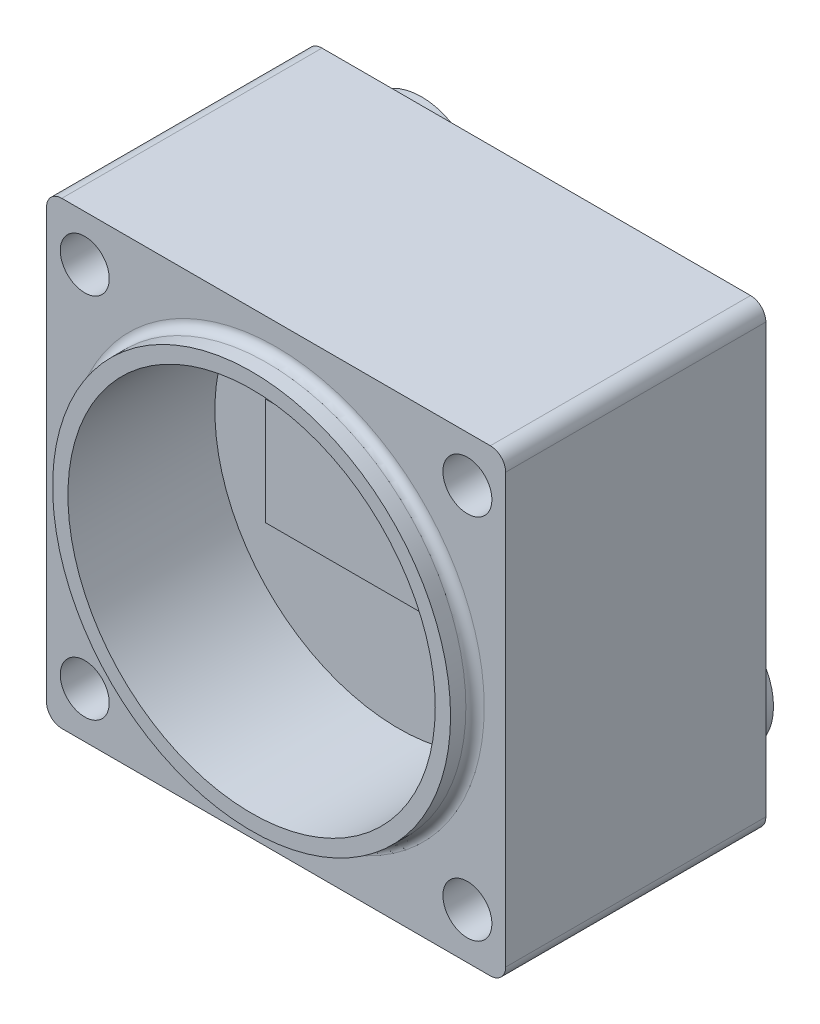
from build123d import *
from build123d.topology import SkipClean

# Parameters (mm, degrees)
SKETCH1_W                   = 15
SKETCH1_H                   = 15
BOSS_EXTRUDE1_DEPTH         = 8.5
SKETCH2_R                   = 6.5
SKETCH2_R_2                 = 6
BOSS_EXTRUDE2_DEPTH         = 0.8
FILLET1_R                   = 0.3
CUT_EXTRUDE1_START          = -4
SKETCH3_R                   = 6
CUT_EXTRUDE1_DEPTH          = 4
FILLET2_R                   = 0.5
SKETCH4_W                   = 7.5
SKETCH4_H                   = 3.5
BOSS_EXTRUDE3_DEPTH         = 0.6
TAP_DRILL_FOR_M2_TAP1_D     = 1.6
TAP_DRILL_FOR_M2_TAP1_DEPTH = 2.5
TAP_DRILL_FOR_M3_TAP1_D     = 2.5
TAP_DRILL_FOR_M3_TAP1_DEPTH = 2.25
SKETCH11_R                  = 2
SKETCH11_R_2                = 1.25
BOSS_EXTRUDE4_DEPTH         = 1
SKETCH12_W                  = 5
SKETCH12_H                  = 2.5
CUT_EXTRUDE2_DEPTH          = 0.4
BOSS_EXTRUDE5_DEPTH         = 0.2


with BuildPart() as part:
    # Sketch1 → Boss-Extrude1 (new body)
    with BuildSketch(Plane.XY):
        Rectangle(SKETCH1_W, SKETCH1_H)
    extrude(amount=BOSS_EXTRUDE1_DEPTH)

    # Sketch2 → Boss-Extrude2 (add)
    with BuildSketch(Plane.XY.offset(8.5)):
        Circle(SKETCH2_R)
        Circle(SKETCH2_R_2, mode=Mode.SUBTRACT)
    extrude(amount=BOSS_EXTRUDE2_DEPTH)

    # Fillet1
    fillet1_edges = [part.edges().sort_by_distance(p)[0] for p in [
        (-6.5, 0, 8.5),
    ]]
    fillet(fillet1_edges, radius=FILLET1_R)

    # Sketch3 → Cut-Extrude1 (cut)
    with BuildSketch(Plane.XY.offset(8.5).offset(CUT_EXTRUDE1_START)):
        Circle(SKETCH3_R)
    extrude(amount=CUT_EXTRUDE1_DEPTH, mode=Mode.SUBTRACT)

    # Fillet2
    fillet2_edges = [part.edges().sort_by_distance(p)[0] for p in [
        (-7.5, 7.5, 4.25),
        (7.5, 7.5, 4.25),
        (7.5, -7.5, 4.25),
        (-7.5, -7.5, 4.25),
    ]]
    fillet(fillet2_edges, radius=FILLET2_R)

    # Sketch4 → Boss-Extrude3 (add)
    with BuildSketch(Plane.XY.offset(4.5)):
        Rectangle(SKETCH4_W, SKETCH4_H)
    extrude(amount=BOSS_EXTRUDE3_DEPTH)

    # Tap Drill for M2 Tap1
    with Locations(Plane.XY.offset(8.5)):
        with Locations((-6.25, 6), (6.25, 6), (6.25, -6), (-6.25, -6)):
            Hole(TAP_DRILL_FOR_M2_TAP1_D / 2, depth=TAP_DRILL_FOR_M2_TAP1_DEPTH)

    # Tap Drill for M3 Tap1
    with Locations(Plane(origin=(0, 0, 0), x_dir=(-1, 0, 0), z_dir=(0, 0, -1))):
        with Locations((4.75, 4.75), (-4.75, -4.75)):
            Hole(TAP_DRILL_FOR_M3_TAP1_D / 2, depth=TAP_DRILL_FOR_M3_TAP1_DEPTH)

    # Sketch11 → Boss-Extrude4 (add)
    # profile 1 of 2: a face of its own
    with SkipClean():  # the faces are left unmerged after this step: merging them gives an invalid solid
        with BuildSketch(Plane(origin=(0, 0, 0), x_dir=(-1, 0, 0), z_dir=(0, 0, -1))):
            with Locations(Location((-4.75, -4.75, 0), (0, 0, 180))):
                Circle(SKETCH11_R)
            with Locations((-4.75, -4.75)):
                Circle(SKETCH11_R_2, mode=Mode.SUBTRACT)
        # profile 2 of 2: a face of its own
        with BuildSketch(Plane(origin=(0, 0, 0), x_dir=(-1, 0, 0), z_dir=(0, 0, -1))):
            with Locations(Location((4.75, 4.75, 0), (0, 0, 180))):
                Circle(SKETCH11_R)
            with Locations((4.75, 4.75)):
                Circle(SKETCH11_R_2, mode=Mode.SUBTRACT)
        extrude(amount=BOSS_EXTRUDE4_DEPTH)

    # Sketch12 → Cut-Extrude2 (cut)
    with SkipClean():  # the faces are left unmerged after this step: merging them gives an invalid solid
        with BuildSketch(Plane(origin=(0, 0, 0), x_dir=(-1, 0, 0), z_dir=(0, 0, -1))):
            with Locations((-2.7, 4)):
                Rectangle(SKETCH12_W, SKETCH12_H)
        extrude(amount=-CUT_EXTRUDE2_DEPTH, mode=Mode.SUBTRACT)

    # Sketch13 → Boss-Extrude5 (add)
    # profile 1 of 12: a face of its own
    with SkipClean():  # the faces are left unmerged after this step: merging them gives an invalid solid
        with BuildSketch(Plane(origin=(0, 0, 0.4), x_dir=(-1, 0, 0), z_dir=(0, 0, -1))):
            with BuildLine():
                Line((-4.668821069, 4.085005407), (-4.600979189, 4.085005407))
                Line((-4.600979189, 4.085005407), (-4.600979189, 3.912856635))
                add(Edge.make_bspline(
                    [(-4.600979189, 3.912856635), (-4.600949528, 3.911072208), (-4.600892243, 3.907625851), (-4.600718619, 3.902672115), (-4.600286284, 3.898127314), (-4.599688066, 3.893995357), (-4.599050164, 3.890225728), (-4.598138113, 3.88688177), (-4.597099975, 3.883943097), (-4.595446545, 3.880585345), (-4.592870724, 3.876804782), (-4.588820933, 3.872940053), (-4.584091056, 3.869391561), (-4.578479821, 3.866455717), (-4.572158554, 3.864089282), (-4.565194463, 3.862335882), (-4.557599025, 3.861350194), (-4.552344338, 3.861203325), (-4.549620766, 3.861127201)],
                    knots=[0, 0, 0, 0, 1.009117585, 1.948962016, 2.801805322, 3.588681075, 4.309712397, 4.961548031, 5.546157113, 6.068856501, 7.074655996, 8.113015292, 9.219846505, 10.40857379, 11.679455231, 13.028936014, 14.460058655, 16, 16, 16, 16], degree=3))
                add(Edge.make_bspline(
                    [(-4.549620766, 3.861127201), (-4.546736438, 3.861188397), (-4.541136905, 3.861307201), (-4.533057242, 3.862508987), (-4.525566275, 3.86437052), (-4.518805958, 3.867087173), (-4.512825167, 3.870321092), (-4.507781064, 3.874042926), (-4.503684974, 3.878165152), (-4.501095998, 3.882107228), (-4.499533877, 3.885677996), (-4.498545123, 3.888880657), (-4.497721767, 3.892625708), (-4.496969696, 3.89688273), (-4.496462832, 3.901700184), (-4.49611992, 3.907040578), (-4.495819817, 3.912924093), (-4.495822747, 3.917025642), (-4.495824275, 3.91916381)],
                    knots=[0, 0, 0, 0, 1.491008905, 2.894591862, 4.215656619, 5.474865643, 6.652787714, 7.723869584, 8.706202526, 9.644083989, 10.143303943, 10.718472251, 11.374691523, 12.125915579, 12.953475506, 13.878715633, 14.894158897, 16, 16, 16, 16], degree=3))
                Line((-4.495824275, 3.91916381), (-4.495824275, 4.085005407))
                Line((-4.495824275, 4.085005407), (-4.427982394, 4.085005407))
                Line((-4.427982394, 4.085005407), (-4.427982394, 3.927167032))
                add(Edge.make_bspline(
                    [(-4.427982394, 3.927167032), (-4.428007134, 3.92396921), (-4.428054709, 3.91781977), (-4.428292044, 3.908981387), (-4.42879384, 3.900907803), (-4.429360579, 3.893595318), (-4.430311327, 3.887065814), (-4.431268077, 3.881268013), (-4.432455943, 3.876225879), (-4.43439509, 3.870473113), (-4.437642704, 3.863826011), (-4.442828141, 3.856251988), (-4.44935584, 3.848818075), (-4.45713569, 3.841666522), (-4.465883724, 3.835001245), (-4.475409106, 3.829142054), (-4.485601137, 3.824234281), (-4.496496146, 3.820318007), (-4.508165042, 3.817264158), (-4.520696221, 3.815230431), (-4.534113142, 3.813838425), (-4.543362745, 3.813706154), (-4.548136724, 3.813637885)],
                    knots=[0, 0, 0, 0, 1.002104641, 1.927056277, 2.770025148, 3.53689708, 4.224316834, 4.836856441, 5.377985188, 5.845421336, 6.73681054, 7.685739899, 8.713795979, 9.830302055, 10.991812556, 12.154944736, 13.328621968, 14.53000517, 15.777458768, 17.102624325, 18.504583029, 20, 20, 20, 20], degree=3))
                add(Edge.make_bspline(
                    [(-4.548136724, 3.813637885), (-4.551318082, 3.813675359), (-4.557563667, 3.813748927), (-4.56677502, 3.814425078), (-4.575676703, 3.815399368), (-4.584276305, 3.816832228), (-4.592559049, 3.818683561), (-4.60052651, 3.82095799), (-4.608163576, 3.823672596), (-4.615456495, 3.826729324), (-4.622341295, 3.830111405), (-4.628733089, 3.833765097), (-4.634656096, 3.837587744), (-4.640073379, 3.841605), (-4.644973305, 3.845849006), (-4.649339963, 3.850327365), (-4.653225329, 3.854990727), (-4.656665211, 3.859956222), (-4.659579956, 3.865505567), (-4.662049107, 3.871803182), (-4.664155075, 3.878952305), (-4.665883591, 3.886941491), (-4.667183305, 3.895797117), (-4.668115123, 3.905490802), (-4.668699597, 3.916047302), (-4.668779566, 3.923367797), (-4.668821069, 3.927167032)],
                    knots=[0, 0, 0, 0, 1.194681672, 2.345378368, 3.467245921, 4.55702161, 5.617889756, 6.653301422, 7.666967707, 8.660253073, 9.621734216, 10.545997581, 11.423914759, 12.267952269, 13.076937024, 13.855864633, 14.614547226, 15.354425808, 16.120242101, 16.963052831, 17.890977035, 18.916583062, 20.030494565, 21.250647704, 22.573124445, 24, 24, 24, 24], degree=3))
                Line((-4.668821069, 3.927167032), (-4.668821069, 4.085005407))
            make_face()
        # profile 2 of 12: a face of its own
        with BuildSketch(Plane(origin=(0, 0, 0.4), x_dir=(-1, 0, 0), z_dir=(0, 0, -1))):
            with BuildLine():
                Line((-4.126086027, 4.049653427), (-4.175536397, 4.017163526))
                add(Edge.make_bspline(
                    [(-4.175536397, 4.017163526), (-4.177676191, 4.019319081), (-4.18183125, 4.023504742), (-4.188427477, 4.02901326), (-4.195006567, 4.033714699), (-4.201621452, 4.037595063), (-4.208310279, 4.040572143), (-4.215026245, 4.042710804), (-4.221770785, 4.044054584), (-4.226288146, 4.044218597), (-4.228537866, 4.044300278)],
                    knots=[0, 0, 0, 0, 1.190525164, 2.311765056, 3.36520098, 4.358604661, 5.313879002, 6.229751941, 7.118387239, 8, 8, 8, 8], degree=3))
                add(Edge.make_bspline(
                    [(-4.228537866, 4.044300278), (-4.230626883, 4.044248655), (-4.234637328, 4.044149551), (-4.2403683, 4.043136738), (-4.245512787, 4.04144168), (-4.249989741, 4.039150591), (-4.253612034, 4.036438477), (-4.25637651, 4.033545339), (-4.258033777, 4.030319347), (-4.258265432, 4.028062484), (-4.258377693, 4.026968798)],
                    knots=[0, 0, 0, 0, 1.330159043, 2.553607876, 3.692836374, 4.770373652, 5.743066602, 6.563974043, 7.304095923, 8, 8, 8, 8], degree=3))
                add(Edge.make_bspline(
                    [(-4.258377693, 4.026968798), (-4.258303641, 4.025864627), (-4.258153019, 4.023618774), (-4.256969182, 4.020318634), (-4.255015539, 4.017162131), (-4.253288342, 4.0152813), (-4.252388527, 4.014301447)],
                    knots=[0, 0, 0, 0, 0.920298768, 1.871862052, 2.891308131, 4, 4, 4, 4], degree=3))
                add(Edge.make_bspline(
                    [(-4.252388527, 4.014301447), (-4.251551405, 4.013528772), (-4.249594355, 4.011722388), (-4.245919012, 4.008980343), (-4.241350508, 4.005514238), (-4.235688126, 4.00155425), (-4.229035676, 3.997001186), (-4.221310659, 3.991936769), (-4.212646277, 3.986178079), (-4.206461264, 3.982241949), (-4.203203164, 3.980168501)],
                    knots=[0, 0, 0, 0, 0.45603203, 1.0661256, 1.834627495, 2.75350167, 3.833023019, 5.063610394, 6.45318828, 8, 8, 8, 8], degree=3))
                add(Edge.make_bspline(
                    [(-4.203203164, 3.980168501), (-4.200164773, 3.978242244), (-4.194402706, 3.974589253), (-4.186218085, 3.969412137), (-4.179025121, 3.964714706), (-4.172707011, 3.960686386), (-4.167408109, 3.957097007), (-4.162993014, 3.954135379), (-4.159508661, 3.951742995), (-4.157547416, 3.950263266), (-4.156720876, 3.949639655)],
                    knots=[0, 0, 0, 0, 1.552293685, 2.943801188, 4.178653364, 5.259149018, 6.176746603, 6.940011425, 7.553282258, 8, 8, 8, 8], degree=3))
                add(Edge.make_bspline(
                    [(-4.156720876, 3.949639655), (-4.153537748, 3.947123527), (-4.147480736, 3.942335716), (-4.139462494, 3.934824888), (-4.132877268, 3.927495181), (-4.127769956, 3.920180608), (-4.123997282, 3.912757281), (-4.121216496, 3.905141297), (-4.11960778, 3.897147446), (-4.119404336, 3.891698319), (-4.119301839, 3.888952973)],
                    knots=[0, 0, 0, 0, 1.312468895, 2.497429846, 3.550423517, 4.495533471, 5.375034974, 6.237577385, 7.112066805, 8, 8, 8, 8], degree=3))
                add(Edge.make_bspline(
                    [(-4.119301839, 3.888952973), (-4.119387749, 3.886277812), (-4.119556868, 3.881011647), (-4.121071335, 3.87331213), (-4.123348453, 3.865934316), (-4.126784742, 3.858993531), (-4.131046891, 3.852345447), (-4.136325551, 3.846101835), (-4.142556914, 3.840238088), (-4.149618328, 3.834767985), (-4.157449451, 3.829811789), (-4.165901651, 3.825448056), (-4.174952917, 3.821788541), (-4.184589913, 3.81883512), (-4.194778537, 3.816516854), (-4.205541266, 3.814816723), (-4.216875466, 3.81380127), (-4.224631318, 3.813693106), (-4.228590868, 3.813637885)],
                    knots=[0, 0, 0, 0, 0.868811549, 1.71029202, 2.542211582, 3.371927485, 4.219482013, 5.104152839, 6.022326931, 6.99656169, 8.003564138, 9.031077577, 10.084838529, 11.1730359, 12.304379326, 13.479039229, 14.712988716, 16, 16, 16, 16], degree=3))
                add(Edge.make_bspline(
                    [(-4.228590868, 3.813637885), (-4.231701384, 3.813677612), (-4.2378407, 3.813756022), (-4.24689776, 3.814406524), (-4.255655583, 3.815455898), (-4.264097283, 3.816935533), (-4.272236584, 3.818849941), (-4.280081603, 3.821171565), (-4.2876235, 3.823931297), (-4.2948737, 3.827117917), (-4.301832931, 3.830785821), (-4.308527197, 3.834929848), (-4.314953336, 3.83955457), (-4.321135597, 3.844669732), (-4.327041643, 3.850288861), (-4.332751858, 3.856350475), (-4.338163413, 3.862925509), (-4.341493995, 3.867608012), (-4.343180044, 3.869978447)],
                    knots=[0, 0, 0, 0, 1.118567985, 2.207749923, 3.263810248, 4.289619113, 5.288307529, 6.26935655, 7.230197879, 8.174681463, 9.115438921, 10.05701139, 11.003928279, 11.960643095, 12.940456797, 13.933876122, 14.954061372, 16, 16, 16, 16], degree=3))
                Line((-4.343180044, 3.869978447), (-4.286680478, 3.895048142))
                add(Edge.make_bspline(
                    [(-4.286680478, 3.895048142), (-4.284555144, 3.892357092), (-4.280438615, 3.887144838), (-4.273666226, 3.880230675), (-4.266704418, 3.874325009), (-4.259454071, 3.869505287), (-4.251940111, 3.865759337), (-4.244176302, 3.863081789), (-4.236169321, 3.861428912), (-4.230736319, 3.861228067), (-4.228007852, 3.861127201)],
                    knots=[0, 0, 0, 0, 1.168605251, 2.263454204, 3.293961514, 4.276421015, 5.224765032, 6.148763627, 7.070304121, 8, 8, 8, 8], degree=3))
                add(Edge.make_bspline(
                    [(-4.228007852, 3.861127201), (-4.225226243, 3.861207766), (-4.219870529, 3.861362886), (-4.212197837, 3.86285932), (-4.205156825, 3.865116041), (-4.199042857, 3.868493762), (-4.193835383, 3.872252571), (-4.190061787, 3.876582428), (-4.187574248, 3.881241872), (-4.187285819, 3.884561443), (-4.187143719, 3.886196896)],
                    knots=[0, 0, 0, 0, 1.271814217, 2.448753583, 3.56637365, 4.641061586, 5.634205734, 6.488609534, 7.255383409, 8, 8, 8, 8], degree=3))
                add(Edge.make_bspline(
                    [(-4.187143719, 3.886196896), (-4.187242019, 3.887714807), (-4.187444635, 3.890843524), (-4.189324813, 3.895416319), (-4.192124959, 3.899996765), (-4.195416485, 3.903680007), (-4.19874683, 3.906793034), (-4.201995671, 3.909463479), (-4.205857558, 3.912503333), (-4.210439064, 3.915755136), (-4.215640131, 3.919375449), (-4.221515073, 3.923295458), (-4.228096883, 3.927459107), (-4.232705608, 3.930332217), (-4.235110048, 3.931831161)],
                    knots=[0, 0, 0, 0, 0.794434314, 1.637487225, 2.562413113, 3.608512959, 4.219241158, 4.95728375, 5.816984293, 6.801079997, 7.908280076, 9.146584944, 10.511331137, 12, 12, 12, 12], degree=3))
                add(Edge.make_bspline(
                    [(-4.235110048, 3.931831161), (-4.239692219, 3.934682984), (-4.248484905, 3.940155322), (-4.260999736, 3.948169688), (-4.27220543, 3.955774636), (-4.282158989, 3.962832058), (-4.29082203, 3.969406534), (-4.298230247, 3.975450265), (-4.304394285, 3.980961801), (-4.309379439, 3.986114937), (-4.313365807, 3.991062078), (-4.316803319, 3.995862869), (-4.319725322, 4.000649085), (-4.3220748, 4.005484923), (-4.323961136, 4.010275056), (-4.325213627, 4.01510211), (-4.326068533, 4.019889261), (-4.326169431, 4.023096075), (-4.326219574, 4.024689735)],
                    knots=[0, 0, 0, 0, 1.916196781, 3.676973209, 5.275785729, 6.723906262, 8.008545569, 9.136149616, 10.117571378, 10.942733828, 11.678437588, 12.371144969, 13.038098532, 13.6664772, 14.278038524, 14.862291426, 15.434603922, 16, 16, 16, 16], degree=3))
                add(Edge.make_bspline(
                    [(-4.326219574, 4.024689735), (-4.326144456, 4.02695785), (-4.325995823, 4.031445716), (-4.324608709, 4.038047173), (-4.322369678, 4.044386303), (-4.319260836, 4.050475865), (-4.315281279, 4.056306013), (-4.310425627, 4.061889677), (-4.304654734, 4.067178689), (-4.298113315, 4.072186498), (-4.290912774, 4.076727613), (-4.283260114, 4.080798146), (-4.275156832, 4.0841757), (-4.266659658, 4.087003366), (-4.257739803, 4.089161891), (-4.24842204, 4.090696602), (-4.238696788, 4.09160112), (-4.232073207, 4.091725959), (-4.228696871, 4.091789595)],
                    knots=[0, 0, 0, 0, 0.832202766, 1.646659515, 2.465524548, 3.295498105, 4.150387516, 5.051997593, 6.007082385, 7.020705296, 8.073791693, 9.130350931, 10.200531492, 11.294237454, 12.416370906, 13.567418749, 14.760004378, 16, 16, 16, 16], degree=3))
                add(Edge.make_bspline(
                    [(-4.228696871, 4.091789595), (-4.224309618, 4.091677322), (-4.215625752, 4.091455096), (-4.202768825, 4.089684113), (-4.190230202, 4.086914483), (-4.180026983, 4.083548442), (-4.171922047, 4.080260083), (-4.16571293, 4.077279587), (-4.15941329, 4.073792934), (-4.152921373, 4.069971908), (-4.146421778, 4.06548655), (-4.139682949, 4.060723422), (-4.132888528, 4.055378929), (-4.128389507, 4.051592211), (-4.126086027, 4.049653427)],
                    knots=[0, 0, 0, 0, 1.389820793, 2.750928363, 4.10510972, 5.45420087, 6.149736827, 6.875939553, 7.635083208, 8.431051425, 9.261799364, 10.136509639, 11.045900652, 12, 12, 12, 12], degree=3))
            make_face()
        # profile 3 of 12: a face of its own
        with BuildSketch(Plane(origin=(0, 0, 0.4), x_dir=(-1, 0, 0), z_dir=(0, 0, -1))):
            with BuildLine():
                Line((-4.024323206, 3.820422073), (-4.024323206, 4.085005407))
                Line((-4.024323206, 4.085005407), (-3.966498603, 4.085005407))
                add(Edge.make_bspline(
                    [(-3.966498603, 4.085005407), (-3.962452627, 4.085005827), (-3.954624699, 4.085006641), (-3.943317213, 4.084714325), (-3.932840483, 4.084341155), (-3.923222343, 4.083916621), (-3.914443984, 4.083192944), (-3.906504853, 4.082427261), (-3.899391277, 4.081506349), (-3.894961268, 4.080677677), (-3.892879563, 4.080288276)],
                    knots=[0, 0, 0, 0, 1.314476142, 2.543174751, 3.67467149, 4.72063089, 5.670668527, 6.535965194, 7.312035703, 8, 8, 8, 8], degree=3))
                add(Edge.make_bspline(
                    [(-3.892879563, 4.080288276), (-3.890186546, 4.079737884), (-3.88490593, 4.078658645), (-3.877284792, 4.076522441), (-3.870086922, 4.074071581), (-3.863287671, 4.071338099), (-3.856906646, 4.068208185), (-3.850964016, 4.064701398), (-3.845432715, 4.060880683), (-3.840350103, 4.056767392), (-3.835782382, 4.052377375), (-3.831802314, 4.047754931), (-3.828363465, 4.042975444), (-3.825581206, 4.037961456), (-3.823468836, 4.032736502), (-3.821900509, 4.027344074), (-3.820989495, 4.021734881), (-3.820862093, 4.017926435), (-3.820797565, 4.015997494)],
                    knots=[0, 0, 0, 0, 1.257922464, 2.466603506, 3.620043909, 4.737393883, 5.818840065, 6.870202274, 7.893186651, 8.893542983, 9.860148194, 10.789108699, 11.682244951, 12.551029152, 13.407072112, 14.256903723, 15.117138701, 16, 16, 16, 16], degree=3))
                add(Edge.make_bspline(
                    [(-3.820797565, 4.015997494), (-3.820907246, 4.013513714), (-3.821124711, 4.008589096), (-3.822944945, 4.001399887), (-3.825914008, 3.994575866), (-3.830059486, 3.988049898), (-3.835624556, 3.981893538), (-3.842535473, 3.97594358), (-3.850924167, 3.970230674), (-3.857159854, 3.966810597), (-3.860442664, 3.965010081)],
                    knots=[0, 0, 0, 0, 0.872773716, 1.73045845, 2.590594071, 3.481956528, 4.43730071, 5.499037926, 6.683355727, 8, 8, 8, 8], degree=3))
                add(Edge.make_bspline(
                    [(-3.860442664, 3.965010081), (-3.857784019, 3.964061046), (-3.852603628, 3.962211844), (-3.845191039, 3.959138621), (-3.838314, 3.955910448), (-3.832011819, 3.95247745), (-3.826265177, 3.948857538), (-3.821035917, 3.945118545), (-3.816411711, 3.94112115), (-3.812312815, 3.936963988), (-3.808660443, 3.932676196), (-3.805590408, 3.928115618), (-3.802910015, 3.923424865), (-3.800802109, 3.918484188), (-3.799067868, 3.913411176), (-3.797942614, 3.908106091), (-3.797139041, 3.902634302), (-3.797081901, 3.898902667), (-3.797052907, 3.897009196)],
                    knots=[0, 0, 0, 0, 1.354375528, 2.639011242, 3.848679929, 4.998155777, 6.080063206, 7.105953475, 8.07969673, 9.00883845, 9.905387834, 10.777723636, 11.643111739, 12.493547544, 13.351387362, 14.211110016, 15.092298084, 16, 16, 16, 16], degree=3))
                add(Edge.make_bspline(
                    [(-3.797052907, 3.897009196), (-3.797106459, 3.895186784), (-3.797212962, 3.891562382), (-3.797989539, 3.886189632), (-3.799177684, 3.880922889), (-3.800981897, 3.875798286), (-3.803172015, 3.87077702), (-3.805934281, 3.865896948), (-3.809154102, 3.861141695), (-3.812868304, 3.856557449), (-3.816941468, 3.852166666), (-3.82133017, 3.848035985), (-3.826024343, 3.844220011), (-3.830951976, 3.840635906), (-3.836222808, 3.837425648), (-3.841753314, 3.834438195), (-3.847573248, 3.831738728), (-3.853735331, 3.829341715), (-3.860303897, 3.827180223), (-3.867457289, 3.825429399), (-3.875168416, 3.823792708), (-3.883518733, 3.822651403), (-3.892419129, 3.821601356), (-3.9019352, 3.820952736), (-3.912044327, 3.820516879), (-3.918991106, 3.820454252), (-3.922560386, 3.820422073)],
                    knots=[0, 0, 0, 0, 0.801347207, 1.593714283, 2.383524159, 3.172377733, 3.979543986, 4.790181617, 5.63507033, 6.502807521, 7.382604636, 8.267705181, 9.151269301, 10.041980737, 10.945615365, 11.863505354, 12.805711295, 13.76534904, 14.770444682, 15.844744415, 17.00300248, 18.236059086, 19.549896115, 20.944554242, 22.430101194, 24, 24, 24, 24], degree=3))
                Line((-3.922560386, 3.820422073), (-4.024323206, 3.820422073))
            make_face()
            with BuildLine():
                Line((-3.956481326, 4.03751609), (-3.956481326, 3.979850492))
                Line((-3.956481326, 3.979850492), (-3.940686888, 3.979850492))
                add(Edge.make_bspline(
                    [(-3.940686888, 3.979850492), (-3.93854851, 3.979864679), (-3.934427215, 3.979892021), (-3.92844904, 3.98027419), (-3.922906399, 3.980880581), (-3.917782002, 3.981807164), (-3.913073229, 3.982874122), (-3.908786169, 3.984270476), (-3.904928896, 3.985886445), (-3.901493295, 3.98776758), (-3.898457873, 3.989822667), (-3.895818583, 3.992103203), (-3.893675368, 3.994641247), (-3.891738638, 3.997213661), (-3.890377761, 4.00009321), (-3.889354284, 4.003112738), (-3.888770785, 4.006329195), (-3.888683722, 4.008522085), (-3.888639445, 4.009637318)],
                    knots=[0, 0, 0, 0, 1.531470513, 2.951601988, 4.289032099, 5.522818593, 6.680046859, 7.744576757, 8.7482429, 9.671368044, 10.545391607, 11.370400094, 12.159694004, 12.921734149, 13.668811109, 14.429168115, 15.201126318, 16, 16, 16, 16], degree=3))
                add(Edge.make_bspline(
                    [(-3.888639445, 4.009637318), (-3.888689184, 4.010681064), (-3.888786769, 4.012728851), (-3.889286967, 4.015724313), (-3.890294608, 4.018521683), (-3.891583778, 4.021200683), (-3.893409094, 4.023627375), (-3.895447848, 4.02601054), (-3.897993024, 4.028107721), (-3.900852664, 4.030083226), (-3.90411181, 4.031825503), (-3.907747323, 4.033367168), (-3.911785774, 4.034693106), (-3.916238692, 4.035736318), (-3.921076929, 4.03651232), (-3.926294881, 4.037088188), (-3.931918162, 4.037475591), (-3.935810062, 4.037502276), (-3.937824809, 4.03751609)],
                    knots=[0, 0, 0, 0, 0.794923146, 1.559606406, 2.299305798, 3.050759689, 3.811771406, 4.602135162, 5.431762038, 6.311701388, 7.243988896, 8.237728068, 9.313205348, 10.473932854, 11.713699693, 13.039329106, 14.467328779, 16, 16, 16, 16], degree=3))
                Line((-3.937824809, 4.03751609), (-3.956481326, 4.03751609))
            make_face(mode=Mode.SUBTRACT)
            with BuildLine():
                Line((-3.956481326, 3.93575327), (-3.956481326, 3.86791139))
                Line((-3.956481326, 3.86791139), (-3.93893784, 3.86791139))
                add(Edge.make_bspline(
                    [(-3.93893784, 3.86791139), (-3.935439431, 3.867926036), (-3.928758409, 3.867954008), (-3.91917701, 3.868318918), (-3.910481712, 3.868959541), (-3.902659863, 3.869767505), (-3.895734951, 3.870857637), (-3.889718704, 3.872239398), (-3.884551714, 3.873776212), (-3.880201252, 3.87563857), (-3.876607213, 3.877845738), (-3.873424506, 3.880077777), (-3.870783235, 3.882661839), (-3.868682497, 3.885499189), (-3.866902651, 3.888484519), (-3.865785872, 3.891774141), (-3.864978108, 3.895238603), (-3.864922917, 3.897640201), (-3.864894787, 3.898864247)],
                    knots=[0, 0, 0, 0, 1.887021404, 3.603704538, 5.170790519, 6.58943757, 7.844387939, 8.949407294, 9.917011509, 10.749176432, 11.492815963, 12.188565757, 12.842251925, 13.475041814, 14.089703505, 14.707680747, 15.341331185, 16, 16, 16, 16], degree=3))
                add(Edge.make_bspline(
                    [(-3.864894787, 3.898864247), (-3.864937399, 3.90026505), (-3.865020767, 3.903005638), (-3.86592254, 3.906980894), (-3.867292157, 3.910745078), (-3.869280766, 3.914255034), (-3.87181355, 3.917539213), (-3.874924919, 3.920554245), (-3.878565447, 3.923382875), (-3.88278623, 3.925989072), (-3.887660016, 3.928340492), (-3.893262283, 3.930329986), (-3.899576195, 3.932006786), (-3.906628683, 3.93335909), (-3.914389317, 3.934485969), (-3.922921808, 3.935173362), (-3.932165312, 3.935675692), (-3.938583707, 3.93572681), (-3.941905922, 3.93575327)],
                    knots=[0, 0, 0, 0, 0.709311656, 1.387725954, 2.056844833, 2.73484476, 3.424876786, 4.153564022, 4.926109345, 5.759117077, 6.664857181, 7.665450765, 8.769654723, 9.975193512, 11.305789465, 12.744979308, 14.31517407, 16, 16, 16, 16], degree=3))
                Line((-3.941905922, 3.93575327), (-3.956481326, 3.93575327))
            make_face(mode=Mode.SUBTRACT)
        # profile 4 of 12: a face of its own
        with BuildSketch(Plane(origin=(0, 0, 0.4), x_dir=(-1, 0, 0), z_dir=(0, 0, -1))):
            with BuildLine():
                Line((-3.203436454, 4.039106134), (-3.250448757, 4.005821212))
                add(Edge.make_bspline(
                    [(-3.250448757, 4.005821212), (-3.254466978, 4.008887629), (-3.262398903, 4.014940703), (-3.274961126, 4.022834752), (-3.287967664, 4.029389389), (-3.301277226, 4.034922714), (-3.315031151, 4.039089894), (-3.329119229, 4.042124566), (-3.343593136, 4.043983198), (-3.353372166, 4.044193938), (-3.358306746, 4.044300278)],
                    knots=[0, 0, 0, 0, 1.038229587, 2.049454149, 3.043010366, 4.027894538, 5.007378552, 5.991352479, 6.986419527, 8, 8, 8, 8], degree=3))
                add(Edge.make_bspline(
                    [(-3.358306746, 4.044300278), (-3.362443656, 4.044216241), (-3.370576758, 4.044051026), (-3.382522842, 4.042827573), (-3.393963085, 4.040747442), (-3.404916734, 4.037916856), (-3.415346511, 4.034170705), (-3.425311397, 4.029668657), (-3.434758986, 4.024298291), (-3.443602358, 4.018189512), (-3.451689045, 4.011519609), (-3.458780787, 4.004361751), (-3.464766273, 3.996783754), (-3.469700392, 3.988854374), (-3.473504905, 3.980495341), (-3.4761983, 3.971750301), (-3.477917192, 3.962621583), (-3.478102323, 3.956396182), (-3.478196069, 3.953243755)],
                    knots=[0, 0, 0, 0, 1.187885248, 2.335364319, 3.443960736, 4.524407058, 5.580322512, 6.622472728, 7.660799934, 8.696583053, 9.70539989, 10.666872381, 11.584427089, 12.472863723, 13.342442026, 14.213794558, 15.095498587, 16, 16, 16, 16], degree=3))
                add(Edge.make_bspline(
                    [(-3.478196069, 3.953243755), (-3.47813646, 3.951033994), (-3.478018864, 3.946674595), (-3.477345193, 3.94021534), (-3.476093559, 3.93397283), (-3.474485401, 3.927889821), (-3.472277726, 3.922033994), (-3.469608066, 3.916363066), (-3.46655513, 3.910812711), (-3.462932247, 3.90553906), (-3.458899486, 3.900484093), (-3.454430462, 3.895722394), (-3.449592262, 3.891191676), (-3.444348965, 3.886957809), (-3.438700148, 3.883036678), (-3.43268992, 3.879359627), (-3.42625823, 3.87597535), (-3.419471169, 3.872858292), (-3.412356643, 3.870132706), (-3.405053809, 3.867660438), (-3.397520147, 3.865669655), (-3.389803871, 3.864037103), (-3.38192462, 3.862677889), (-3.373832295, 3.86182632), (-3.365560577, 3.861184995), (-3.359968782, 3.861146613), (-3.357140714, 3.861127201)],
                    knots=[0, 0, 0, 0, 0.937496524, 1.849486415, 2.750417344, 3.635754181, 4.515491188, 5.400574255, 6.292955863, 7.199200781, 8.110913523, 9.033495133, 9.966668607, 10.920525903, 11.889309348, 12.881519013, 13.907318609, 14.970354842, 16.047508483, 17.137618491, 18.239207974, 19.350391021, 20.482602104, 21.628789043, 22.800752546, 24, 24, 24, 24], degree=3))
                add(Edge.make_bspline(
                    [(-3.357140714, 3.861127201), (-3.352366445, 3.861229482), (-3.343004511, 3.861430044), (-3.329263354, 3.862991947), (-3.316159527, 3.865570594), (-3.305637704, 3.868618777), (-3.297397267, 3.871633613), (-3.291143936, 3.874457255), (-3.284678475, 3.877542221), (-3.278100493, 3.881130297), (-3.271348649, 3.885099444), (-3.264498929, 3.889561394), (-3.257463338, 3.894402091), (-3.252789031, 3.897843992), (-3.250395756, 3.899606268)],
                    knots=[0, 0, 0, 0, 1.483690097, 2.90938903, 4.292193086, 5.630334046, 6.309691641, 7.01780335, 7.761982048, 8.53595548, 9.345892649, 10.195833925, 11.076255288, 12, 12, 12, 12], degree=3))
                Line((-3.250395756, 3.899606268), (-3.204867494, 3.864148285))
                add(Edge.make_bspline(
                    [(-3.204867494, 3.864148285), (-3.208086086, 3.861848456), (-3.214418583, 3.857323602), (-3.224004598, 3.851006946), (-3.233516431, 3.845305084), (-3.242817191, 3.84003202), (-3.252001867, 3.835336998), (-3.261087286, 3.831288887), (-3.269981986, 3.827624225), (-3.278867883, 3.824613119), (-3.287824181, 3.82195918), (-3.297035177, 3.819775712), (-3.30652177, 3.817843622), (-3.316323216, 3.816326212), (-3.32643205, 3.815090295), (-3.336866255, 3.814277842), (-3.347594139, 3.813709995), (-3.354843206, 3.813662146), (-3.358518752, 3.813637885)],
                    knots=[0, 0, 0, 0, 1.151113728, 2.264786595, 3.339604625, 4.377795044, 5.375689211, 6.339863542, 7.27166599, 8.174026306, 9.068811971, 9.989082755, 10.927795337, 11.885464148, 12.874538463, 13.89070127, 14.930507155, 16, 16, 16, 16], degree=3))
                add(Edge.make_bspline(
                    [(-3.358518752, 3.813637885), (-3.365236098, 3.813765045), (-3.378395152, 3.814014148), (-3.397670605, 3.815815887), (-3.41600574, 3.818878681), (-3.433399139, 3.823156624), (-3.449853647, 3.828681581), (-3.465386941, 3.835407919), (-3.479981121, 3.843401405), (-3.491363401, 3.851038695), (-3.49985558, 3.857691037), (-3.505826176, 3.862846732), (-3.511362199, 3.868190266), (-3.51654913, 3.873657091), (-3.521277265, 3.87933929), (-3.525551278, 3.885217167), (-3.529453882, 3.891245115), (-3.532956647, 3.897432811), (-3.536018271, 3.903820702), (-3.53875947, 3.910326048), (-3.540962776, 3.917057696), (-3.542837894, 3.923933371), (-3.544241969, 3.931004204), (-3.545337956, 3.938215104), (-3.545900886, 3.945620141), (-3.545991873, 3.950610557), (-3.54603795, 3.953137752)],
                    knots=[0, 0, 0, 0, 1.854242412, 3.632398211, 5.338628587, 6.981657757, 8.571767065, 10.124763514, 11.648247808, 13.15920557, 13.902647685, 14.625273405, 15.335833078, 16.025877133, 16.704660648, 17.374839119, 18.030956841, 18.686113137, 19.336148312, 19.985561112, 20.633323558, 21.289930521, 21.951823402, 22.622250278, 23.302294172, 24, 24, 24, 24], degree=3))
                add(Edge.make_bspline(
                    [(-3.54603795, 3.953137752), (-3.545967501, 3.956391697), (-3.545827718, 3.962848122), (-3.544688128, 3.972367843), (-3.542842159, 3.981630213), (-3.540168106, 3.990569847), (-3.536824046, 3.999290974), (-3.53268645, 4.007685119), (-3.527817533, 4.015825714), (-3.522192439, 4.023641215), (-3.515899132, 4.031165886), (-3.508895292, 4.038299758), (-3.501280251, 4.045063395), (-3.493014578, 4.051461242), (-3.48409241, 4.05743615), (-3.47453301, 4.063058119), (-3.464335103, 4.068299789), (-3.453566059, 4.073158261), (-3.442361902, 4.077510583), (-3.430871548, 4.081357755), (-3.419170619, 4.084565113), (-3.407258671, 4.087259193), (-3.395125985, 4.089217834), (-3.382790608, 4.09074951), (-3.370243451, 4.091576967), (-3.361805899, 4.091718468), (-3.357564726, 4.091789595)],
                    knots=[0, 0, 0, 0, 0.901846024, 1.789428475, 2.653913408, 3.51710706, 4.373002704, 5.240410191, 6.108094187, 6.999707968, 7.907122633, 8.824946241, 9.768582249, 10.728662328, 11.720305377, 12.743416927, 13.801442477, 14.897498318, 16.01713447, 17.132283772, 18.255171826, 19.379276919, 20.51620885, 21.660742739, 22.824162147, 24, 24, 24, 24], degree=3))
                add(Edge.make_bspline(
                    [(-3.357564726, 4.091789595), (-3.353924276, 4.091750062), (-3.346690807, 4.091671511), (-3.335888795, 4.091002389), (-3.325185096, 4.089976372), (-3.314604214, 4.088400212), (-3.304105646, 4.086526067), (-3.293743428, 4.084099989), (-3.283431737, 4.081383648), (-3.273299529, 4.078125564), (-3.263360783, 4.074569029), (-3.25376272, 4.070555898), (-3.244456116, 4.0663056), (-3.235570848, 4.061559283), (-3.22699916, 4.056521243), (-3.218785088, 4.05111754), (-3.210905763, 4.045338659), (-3.205924191, 4.041181947), (-3.203436454, 4.039106134)],
                    knots=[0, 0, 0, 0, 1.051020203, 2.088346762, 3.123802826, 4.154687706, 5.176241514, 6.202065689, 7.226608083, 8.254256982, 9.274064467, 10.273485341, 11.257160534, 12.22696929, 13.18055717, 14.127064957, 15.064678665, 16, 16, 16, 16], degree=3))
            make_face()
        # profile 5 of 12: a face of its own
        with BuildSketch(Plane(origin=(0, 0, 0.4), x_dir=(-1, 0, 0), z_dir=(0, 0, -1))):
            with BuildLine():
                add(Edge.make_bspline(
                    [(-2.986236434, 4.017163526), (-2.983090642, 4.017123198), (-2.976845597, 4.017043137), (-2.967541858, 4.016388173), (-2.958402732, 4.015321125), (-2.949389392, 4.013913906), (-2.940533267, 4.011985293), (-2.931818411, 4.009654996), (-2.923223438, 4.006960228), (-2.914874669, 4.003779415), (-2.906778222, 4.000309197), (-2.899084744, 3.99651049), (-2.89187399, 3.992343373), (-2.885039102, 3.987981642), (-2.87877522, 3.983179028), (-2.872863864, 3.978210278), (-2.867537502, 3.97281849), (-2.862597636, 3.967236066), (-2.858216179, 3.961415822), (-2.854357532, 3.955461995), (-2.851146528, 3.949365498), (-2.848430355, 3.943187221), (-2.846455563, 3.93684501), (-2.844926434, 3.930425138), (-2.844085873, 3.923867755), (-2.843945158, 3.919466278), (-2.843874488, 3.917255757)],
                    knots=[0, 0, 0, 0, 1.180238987, 2.343017549, 3.497452245, 4.631940519, 5.764393486, 6.896380727, 8.015896749, 9.142436287, 10.246995911, 11.320158565, 12.359435442, 13.370704013, 14.359741289, 15.318892723, 16.265732941, 17.200499405, 18.113963271, 18.996576021, 19.85950276, 20.696843726, 21.524923567, 22.348213702, 23.170435669, 24, 24, 24, 24], degree=3))
                add(Edge.make_bspline(
                    [(-2.843874488, 3.917255757), (-2.843944723, 3.915027439), (-2.844084571, 3.910590496), (-2.844931566, 3.903982597), (-2.846436951, 3.89749616), (-2.848512742, 3.891112303), (-2.851166853, 3.884849807), (-2.854434225, 3.878698591), (-2.85832577, 3.872688723), (-2.862683902, 3.866750147), (-2.867642853, 3.861109777), (-2.872967772, 3.855686301), (-2.878805043, 3.850634315), (-2.885030012, 3.845882353), (-2.891699911, 3.84144603), (-2.898817503, 3.837410815), (-2.90629446, 3.833538394), (-2.914216839, 3.830153223), (-2.922438706, 3.827068893), (-2.930893158, 3.824376128), (-2.939575441, 3.822078626), (-2.948459938, 3.820241814), (-2.957550274, 3.818798024), (-2.966856772, 3.817816843), (-2.976368379, 3.817146539), (-2.982790172, 3.81706902), (-2.986024428, 3.817029979)],
                    knots=[0, 0, 0, 0, 0.83480101, 1.662224516, 2.490600238, 3.325637301, 4.173762661, 5.035260479, 5.931125485, 6.853676745, 7.791880143, 8.741843581, 9.698720445, 10.680849773, 11.67384443, 12.696626731, 13.744368928, 14.826249789, 15.921488206, 17.032843276, 18.14846596, 19.284145644, 20.429827281, 21.594766695, 22.788633966, 24, 24, 24, 24], degree=3))
                add(Edge.make_bspline(
                    [(-2.986024428, 3.817029979), (-2.990744359, 3.817129112), (-3.000043883, 3.817324431), (-3.013724797, 3.818642152), (-3.026868354, 3.820926091), (-3.039482961, 3.824116811), (-3.051608384, 3.828177356), (-3.063166517, 3.833238463), (-3.074226384, 3.839147522), (-3.084598579, 3.845906884), (-3.094101738, 3.853321463), (-3.102470853, 3.861199712), (-3.109538139, 3.869516385), (-3.115326295, 3.878230531), (-3.119895585, 3.887326555), (-3.123075306, 3.896858497), (-3.125068248, 3.906766828), (-3.125300616, 3.913518546), (-3.125418292, 3.916937748)],
                    knots=[0, 0, 0, 0, 1.195031939, 2.354531939, 3.476038823, 4.569641738, 5.646130985, 6.70986765, 7.76055416, 8.817648657, 9.840455459, 10.808680837, 11.722798098, 12.597461294, 13.451673412, 14.291927378, 15.134998583, 16, 16, 16, 16], degree=3))
                add(Edge.make_bspline(
                    [(-3.125418292, 3.916937748), (-3.125270822, 3.920587299), (-3.124979778, 3.927789975), (-3.122806427, 3.938350131), (-3.119163707, 3.948435614), (-3.114001179, 3.95801423), (-3.107474777, 3.967174125), (-3.099425212, 3.97576471), (-3.089985957, 3.983934407), (-3.082910811, 3.988754524), (-3.079254012, 3.991245808)],
                    knots=[0, 0, 0, 0, 0.956735003, 1.88819211, 2.814552587, 3.759818456, 4.733162036, 5.756182667, 6.84027999, 8, 8, 8, 8], degree=3))
                add(Edge.make_bspline(
                    [(-3.079254012, 3.991245808), (-3.07586011, 3.993337538), (-3.069080857, 3.997515727), (-3.058324671, 4.002698551), (-3.047254021, 4.007198796), (-3.035792165, 4.010859234), (-3.023932899, 4.013658588), (-3.011696506, 4.01566685), (-2.999088602, 4.01691347), (-2.990550071, 4.017079599), (-2.986236434, 4.017163526)],
                    knots=[0, 0, 0, 0, 0.976757026, 1.951052783, 2.92260112, 3.904682469, 4.897411824, 5.907059611, 6.942653757, 8, 8, 8, 8], degree=3))
            make_face()
            with BuildLine():
                add(Edge.make_bspline(
                    [(-2.984752393, 3.973066304), (-2.987297326, 3.973004825), (-2.992308061, 3.972883778), (-2.99967369, 3.97224544), (-3.006673116, 3.970923707), (-3.013374199, 3.969262655), (-3.01971278, 3.966996188), (-3.025815873, 3.964401477), (-3.031475222, 3.961105164), (-3.036810796, 3.957484924), (-3.041696476, 3.953512541), (-3.045870891, 3.949110959), (-3.049559449, 3.944562963), (-3.052464886, 3.939633724), (-3.054792459, 3.934471372), (-3.056350713, 3.92898567), (-3.057416722, 3.923268628), (-3.057522783, 3.919345467), (-3.057576411, 3.91736176)],
                    knots=[0, 0, 0, 0, 1.195582156, 2.353989254, 3.467236278, 4.537890828, 5.592835568, 6.625751781, 7.647745157, 8.662707935, 9.652879123, 10.597682748, 11.50740229, 12.396800815, 13.277212732, 14.15942149, 15.069330222, 16, 16, 16, 16], degree=3))
                add(Edge.make_bspline(
                    [(-3.057576411, 3.91736176), (-3.05751846, 3.915308358), (-3.057404898, 3.911284501), (-3.056420532, 3.905415354), (-3.054841983, 3.899831154), (-3.052528659, 3.894584533), (-3.049652211, 3.889576996), (-3.046066913, 3.884932562), (-3.041907527, 3.880523655), (-3.037072338, 3.876560362), (-3.031819031, 3.872887901), (-3.026096384, 3.869795421), (-3.020102405, 3.867039427), (-3.013728292, 3.864908337), (-3.007036833, 3.863185069), (-3.000001001, 3.861974909), (-2.99260978, 3.861301241), (-2.98758046, 3.861185954), (-2.9850174, 3.861127201)],
                    knots=[0, 0, 0, 0, 0.959543058, 1.880325486, 2.77448702, 3.666126447, 4.554507157, 5.46818436, 6.403088237, 7.382516482, 8.386170878, 9.395554388, 10.4197036, 11.467273056, 12.533182667, 13.648187244, 14.8014605, 16, 16, 16, 16], degree=3))
                add(Edge.make_bspline(
                    [(-2.9850174, 3.861127201), (-2.982453987, 3.861181188), (-2.977404687, 3.861287527), (-2.970016694, 3.862031003), (-2.962952433, 3.863263631), (-2.95621653, 3.864920641), (-2.949817098, 3.867192804), (-2.943729928, 3.869854698), (-2.93799052, 3.873085925), (-2.932639428, 3.876763639), (-2.927726645, 3.88079156), (-2.923436391, 3.885176256), (-2.919807285, 3.889843921), (-2.91687167, 3.894821565), (-2.914569716, 3.900052011), (-2.912924652, 3.905568968), (-2.911877681, 3.91136816), (-2.911770697, 3.91534318), (-2.911716369, 3.91736176)],
                    knots=[0, 0, 0, 0, 1.194120799, 2.352127133, 3.454911823, 4.532846036, 5.579243392, 6.614642516, 7.624304568, 8.642484871, 9.636221243, 10.579098854, 11.494416744, 12.3836835, 13.264492702, 14.149789497, 15.060433014, 16, 16, 16, 16], degree=3))
                add(Edge.make_bspline(
                    [(-2.911716369, 3.91736176), (-2.911777081, 3.919379158), (-2.911896549, 3.923348895), (-2.912851234, 3.929162083), (-2.914526549, 3.934642473), (-2.916747567, 3.939867843), (-2.919717809, 3.944737838), (-2.92321203, 3.949410941), (-2.927465578, 3.953696397), (-2.932247171, 3.957704542), (-2.9375644, 3.961279499), (-2.943227917, 3.9644941), (-2.949302237, 3.967119822), (-2.955697174, 3.969311953), (-2.962454407, 3.970996114), (-2.969573515, 3.972225236), (-2.977054514, 3.972890774), (-2.982154124, 3.973007057), (-2.984752393, 3.973066304)],
                    knots=[0, 0, 0, 0, 0.943205826, 1.855993635, 2.744719088, 3.618064089, 4.503673155, 5.405929891, 6.34077541, 7.320371993, 8.319529667, 9.33310203, 10.361617298, 11.409366805, 12.491475739, 13.614814299, 14.784739585, 16, 16, 16, 16], degree=3))
            make_face(mode=Mode.SUBTRACT)
        # profile 6 of 12: a face of its own
        with BuildSketch(Plane(origin=(0, 0, 0.4), x_dir=(-1, 0, 0), z_dir=(0, 0, -1))):
            with BuildLine():
                Line((-2.759072138, 4.013771432), (-2.691230257, 4.013771432))
                Line((-2.691230257, 4.013771432), (-2.691230257, 3.993312865))
                add(Edge.make_bspline(
                    [(-2.691230257, 3.993312865), (-2.687543343, 3.995422819), (-2.680461093, 3.99947586), (-2.669857952, 4.004645555), (-2.65980624, 4.008800502), (-2.65017259, 4.012005033), (-2.640732712, 4.014303037), (-2.631312121, 4.015930801), (-2.621787422, 4.016996543), (-2.615405629, 4.017107753), (-2.612205067, 4.017163526)],
                    knots=[0, 0, 0, 0, 1.219013992, 2.341622817, 3.38312451, 4.338853601, 5.252659577, 6.168868332, 7.08166072, 8, 8, 8, 8], degree=3))
                add(Edge.make_bspline(
                    [(-2.612205067, 4.017163526), (-2.608952524, 4.017098856), (-2.602576035, 4.016972071), (-2.593180108, 4.01608013), (-2.584188803, 4.014473956), (-2.575547644, 4.012320692), (-2.567317496, 4.009485865), (-2.559420197, 4.006107036), (-2.551926083, 4.002019926), (-2.547235826, 3.998828822), (-2.544893201, 3.997234974)],
                    knots=[0, 0, 0, 0, 1.093643889, 2.144048327, 3.169547853, 4.162261341, 5.135389499, 6.093275895, 7.047655905, 8, 8, 8, 8], degree=3))
                add(Edge.make_bspline(
                    [(-2.544893201, 3.997234974), (-2.543031566, 3.995780168), (-2.539365384, 3.992915167), (-2.534639883, 3.987844414), (-2.530536619, 3.982377996), (-2.527304559, 3.976296), (-2.524754039, 3.96972988), (-2.522889048, 3.962659053), (-2.521842743, 3.955077162), (-2.521699213, 3.949872486), (-2.521625557, 3.947201587)],
                    knots=[0, 0, 0, 0, 0.985986535, 1.941737484, 2.886820211, 3.834926289, 4.809764778, 5.825167435, 6.883934444, 8, 8, 8, 8], degree=3))
                Line((-2.521625557, 3.947201587), (-2.521625557, 3.820422073))
                Line((-2.521625557, 3.820422073), (-2.589467437, 3.820422073))
                Line((-2.589467437, 3.820422073), (-2.589467437, 3.9043764))
                add(Edge.make_bspline(
                    [(-2.589467437, 3.9043764), (-2.589470868, 3.907115046), (-2.589477445, 3.912363589), (-2.589711378, 3.919872422), (-2.589991994, 3.926661714), (-2.590489035, 3.932721047), (-2.591028708, 3.938068045), (-2.591779256, 3.942680826), (-2.592587021, 3.946591518), (-2.59391101, 3.950778063), (-2.596029304, 3.955297204), (-2.599329274, 3.960016583), (-2.603468746, 3.96403872), (-2.608381005, 3.96729103), (-2.613946511, 3.96991736), (-2.6201661, 3.971749556), (-2.626987082, 3.972873208), (-2.631740373, 3.973000446), (-2.634200677, 3.973066304)],
                    knots=[0, 0, 0, 0, 1.372380085, 2.63012987, 3.764671006, 4.777153989, 5.676683878, 6.456881102, 7.118556915, 7.67578897, 8.654092719, 9.6071915, 10.546370845, 11.528633006, 12.546521291, 13.619303321, 14.767750981, 16, 16, 16, 16], degree=3))
                add(Edge.make_bspline(
                    [(-2.634200677, 3.973066304), (-2.637424552, 3.972942941), (-2.643678066, 3.972703646), (-2.652716714, 3.970883791), (-2.661033708, 3.967782721), (-2.668579742, 3.963477184), (-2.675240939, 3.958123798), (-2.680843359, 3.951770764), (-2.685341212, 3.94445093), (-2.687344711, 3.9390449), (-2.688368178, 3.936283285)],
                    knots=[0, 0, 0, 0, 1.100021677, 2.13376756, 3.131871994, 4.117803521, 5.087010361, 6.035620462, 6.996516673, 8, 8, 8, 8], degree=3))
                add(Edge.make_bspline(
                    [(-2.688368178, 3.936283285), (-2.688612462, 3.935420996), (-2.689155426, 3.933504407), (-2.68969492, 3.930253399), (-2.690169528, 3.926381138), (-2.690517585, 3.921852201), (-2.690828199, 3.916657407), (-2.69111769, 3.91081021), (-2.691182778, 3.904305796), (-2.691213907, 3.899765215), (-2.691230257, 3.897380206)],
                    knots=[0, 0, 0, 0, 0.549663526, 1.221725058, 2.019221934, 2.943956318, 4.008513207, 5.213253662, 6.536219219, 8, 8, 8, 8], degree=3))
                Line((-2.691230257, 3.897380206), (-2.691230257, 3.820422073))
                Line((-2.691230257, 3.820422073), (-2.759072138, 3.820422073))
                Line((-2.759072138, 3.820422073), (-2.759072138, 4.013771432))
            make_face()
        # profile 7 of 12: a face of its own
        with BuildSketch(Plane(origin=(0, 0, 0.4), x_dir=(-1, 0, 0), z_dir=(0, 0, -1))):
            with BuildLine():
                Line((-2.426646924, 4.013771432), (-2.358805044, 4.013771432))
                Line((-2.358805044, 4.013771432), (-2.358805044, 3.993312865))
                add(Edge.make_bspline(
                    [(-2.358805044, 3.993312865), (-2.355118129, 3.995422819), (-2.348035879, 3.99947586), (-2.337432738, 4.004645555), (-2.327381027, 4.008800502), (-2.317747376, 4.012005033), (-2.308307499, 4.014303037), (-2.298886907, 4.015930801), (-2.289362208, 4.016996543), (-2.282980416, 4.017107753), (-2.279779853, 4.017163526)],
                    knots=[0, 0, 0, 0, 1.219013992, 2.341622817, 3.38312451, 4.338853601, 5.252659577, 6.168868332, 7.08166072, 8, 8, 8, 8], degree=3))
                add(Edge.make_bspline(
                    [(-2.279779853, 4.017163526), (-2.276527311, 4.017098856), (-2.270150821, 4.016972071), (-2.260754894, 4.01608013), (-2.251763589, 4.014473956), (-2.24312243, 4.012320692), (-2.234892283, 4.009485865), (-2.226994984, 4.006107036), (-2.21950087, 4.002019926), (-2.214810612, 3.998828822), (-2.212467988, 3.997234974)],
                    knots=[0, 0, 0, 0, 1.093643889, 2.144048327, 3.169547853, 4.162261341, 5.135389499, 6.093275895, 7.047655905, 8, 8, 8, 8], degree=3))
                add(Edge.make_bspline(
                    [(-2.212467988, 3.997234974), (-2.210606353, 3.995780168), (-2.20694017, 3.992915167), (-2.20221467, 3.987844414), (-2.198111405, 3.982377996), (-2.194879345, 3.976296), (-2.192328825, 3.96972988), (-2.190463834, 3.962659053), (-2.18941753, 3.955077162), (-2.189273999, 3.949872486), (-2.189200343, 3.947201587)],
                    knots=[0, 0, 0, 0, 0.985986535, 1.941737484, 2.886820211, 3.834926289, 4.809764778, 5.825167435, 6.883934444, 8, 8, 8, 8], degree=3))
                Line((-2.189200343, 3.947201587), (-2.189200343, 3.820422073))
                Line((-2.189200343, 3.820422073), (-2.257042223, 3.820422073))
                Line((-2.257042223, 3.820422073), (-2.257042223, 3.9043764))
                add(Edge.make_bspline(
                    [(-2.257042223, 3.9043764), (-2.257045655, 3.907115046), (-2.257052231, 3.912363589), (-2.257286165, 3.919872422), (-2.25756678, 3.926661714), (-2.258063822, 3.932721047), (-2.258603495, 3.938068045), (-2.259354042, 3.942680826), (-2.260161808, 3.946591518), (-2.261485796, 3.950778063), (-2.26360409, 3.955297204), (-2.266904061, 3.960016583), (-2.271043532, 3.96403872), (-2.275955791, 3.96729103), (-2.281521297, 3.96991736), (-2.287740887, 3.971749556), (-2.294561869, 3.972873208), (-2.299315159, 3.973000446), (-2.301775463, 3.973066304)],
                    knots=[0, 0, 0, 0, 1.372380085, 2.63012987, 3.764671006, 4.777153989, 5.676683878, 6.456881102, 7.118556915, 7.67578897, 8.654092719, 9.6071915, 10.546370845, 11.528633006, 12.546521291, 13.619303321, 14.767750981, 16, 16, 16, 16], degree=3))
                add(Edge.make_bspline(
                    [(-2.301775463, 3.973066304), (-2.304999338, 3.972942941), (-2.311252852, 3.972703646), (-2.320291501, 3.970883791), (-2.328608495, 3.967782721), (-2.336154528, 3.963477184), (-2.342815726, 3.958123798), (-2.348418145, 3.951770764), (-2.352915998, 3.94445093), (-2.354919497, 3.9390449), (-2.355942964, 3.936283285)],
                    knots=[0, 0, 0, 0, 1.100021677, 2.13376756, 3.131871994, 4.117803521, 5.087010361, 6.035620462, 6.996516673, 8, 8, 8, 8], degree=3))
                add(Edge.make_bspline(
                    [(-2.355942964, 3.936283285), (-2.356187248, 3.935420996), (-2.356730213, 3.933504407), (-2.357269706, 3.930253399), (-2.357744314, 3.926381138), (-2.358092371, 3.921852201), (-2.358402985, 3.916657407), (-2.358692477, 3.91081021), (-2.358757564, 3.904305796), (-2.358788693, 3.899765215), (-2.358805044, 3.897380206)],
                    knots=[0, 0, 0, 0, 0.549663526, 1.221725058, 2.019221934, 2.943956318, 4.008513207, 5.213253662, 6.536219219, 8, 8, 8, 8], degree=3))
                Line((-2.358805044, 3.897380206), (-2.358805044, 3.820422073))
                Line((-2.358805044, 3.820422073), (-2.426646924, 3.820422073))
                Line((-2.426646924, 3.820422073), (-2.426646924, 4.013771432))
            make_face()
        # profile 8 of 12: a face of its own
        with BuildSketch(Plane(origin=(0, 0, 0.4), x_dir=(-1, 0, 0), z_dir=(0, 0, -1))):
            with BuildLine():
                Line((-1.82651129, 3.905224424), (-2.0433403, 3.905224424))
                add(Edge.make_bspline(
                    [(-2.0433403, 3.905224424), (-2.042898936, 3.903447162), (-2.042024682, 3.899926759), (-2.040093409, 3.89485739), (-2.037652904, 3.890080577), (-2.034707356, 3.885595411), (-2.031294643, 3.881391183), (-2.027398401, 3.877440956), (-2.022992522, 3.8737883), (-2.018098138, 3.870463027), (-2.012814992, 3.867433936), (-2.007130615, 3.864847577), (-2.001098674, 3.862671896), (-1.994720659, 3.860875967), (-1.987995374, 3.859443255), (-1.98091204, 3.858442713), (-1.973476424, 3.8578644), (-1.968397246, 3.857778862), (-1.965799151, 3.857735107)],
                    knots=[0, 0, 0, 0, 0.890489349, 1.763882929, 2.632822447, 3.496001542, 4.370071844, 5.263709565, 6.191632842, 7.150232066, 8.139788705, 9.151540522, 10.184975199, 11.257230183, 12.373456175, 13.528471402, 14.735766877, 16, 16, 16, 16], degree=3))
                add(Edge.make_bspline(
                    [(-1.965799151, 3.857735107), (-1.962686885, 3.857792477), (-1.956553405, 3.857905538), (-1.947525651, 3.858911432), (-1.938791603, 3.860396436), (-1.930423424, 3.862657763), (-1.922374726, 3.865442264), (-1.914700758, 3.868942088), (-1.907301889, 3.87297391), (-1.902698962, 3.876205402), (-1.900395338, 3.877822664)],
                    knots=[0, 0, 0, 0, 1.072805427, 2.114225403, 3.128804282, 4.12475834, 5.09966012, 6.062129816, 7.030155244, 8, 8, 8, 8], degree=3))
                Line((-1.900395338, 3.877822664), (-1.843206753, 3.85890114))
                add(Edge.make_bspline(
                    [(-1.843206753, 3.85890114), (-1.845006808, 3.857165888), (-1.848603631, 3.853698552), (-1.85435275, 3.848884011), (-1.860327977, 3.844384509), (-1.866554793, 3.840208875), (-1.873094966, 3.836468393), (-1.879861452, 3.833016911), (-1.886908885, 3.829931909), (-1.894210258, 3.827174172), (-1.901840482, 3.824780987), (-1.909809484, 3.822737317), (-1.918109176, 3.820910826), (-1.926765488, 3.81950773), (-1.935763622, 3.818384283), (-1.945117575, 3.817608084), (-1.954822559, 3.817117367), (-1.961399427, 3.81705941), (-1.964739122, 3.817029979)],
                    knots=[0, 0, 0, 0, 0.908082715, 1.814508158, 2.72204635, 3.624554952, 4.536078759, 5.457468827, 6.382851623, 7.329360582, 8.291538211, 9.286280562, 10.317300345, 11.377726624, 12.47074897, 13.610847216, 14.786802309, 16, 16, 16, 16], degree=3))
                add(Edge.make_bspline(
                    [(-1.964739122, 3.817029979), (-1.969900836, 3.817103915), (-1.979994767, 3.817248499), (-1.994763442, 3.818595863), (-2.008787229, 3.820811136), (-2.02209997, 3.823873934), (-2.034683729, 3.82782072), (-2.046509196, 3.83274143), (-2.057642342, 3.838447573), (-2.067911092, 3.845048632), (-2.077227913, 3.85226312), (-2.085412906, 3.860001732), (-2.092272828, 3.868267423), (-2.097997231, 3.876901725), (-2.102371562, 3.88606138), (-2.105517679, 3.895657852), (-2.107423389, 3.905714663), (-2.107666779, 3.912565771), (-2.107790086, 3.916036723)],
                    knots=[0, 0, 0, 0, 1.28139234, 2.505811608, 3.678460092, 4.804257881, 5.894717266, 6.948873094, 7.980863206, 8.996927532, 9.975315398, 10.903023854, 11.78763431, 12.636885436, 13.468795489, 14.299733468, 15.138600029, 16, 16, 16, 16], degree=3))
                add(Edge.make_bspline(
                    [(-2.107790086, 3.916036723), (-2.107667534, 3.919596168), (-2.107425601, 3.926622959), (-2.105515895, 3.936898562), (-2.10243983, 3.946727636), (-2.098011908, 3.956035588), (-2.092510288, 3.964989507), (-2.085546076, 3.973299497), (-2.077509505, 3.981261675), (-2.068258035, 3.988606184), (-2.058085633, 3.995261239), (-2.047239531, 4.001215001), (-2.035696924, 4.006114553), (-2.023549069, 4.010141321), (-2.010801652, 4.013354989), (-1.99741019, 4.015508649), (-1.98341024, 4.016966882), (-1.97385929, 4.017097028), (-1.968979239, 4.017163526)],
                    knots=[0, 0, 0, 0, 0.89445685, 1.765770289, 2.618530966, 3.477011064, 4.350936295, 5.253573403, 6.195911284, 7.191432947, 8.217727186, 9.249381351, 10.29811797, 11.36570757, 12.464628521, 13.599484877, 14.773458673, 16, 16, 16, 16], degree=3))
                add(Edge.make_bspline(
                    [(-1.968979239, 4.017163526), (-1.963817603, 4.017089363), (-1.953723825, 4.016944335), (-1.938954056, 4.015600145), (-1.924934167, 4.013373565), (-1.911618876, 4.010353153), (-1.899100773, 4.006272062), (-1.887242937, 4.001496405), (-1.876199962, 3.995672449), (-1.865926518, 3.989085798), (-1.856635845, 3.981779599), (-1.848481555, 3.973857459), (-1.841643796, 3.965289605), (-1.835973796, 3.956202944), (-1.831572507, 3.946511933), (-1.828514905, 3.936239025), (-1.826602243, 3.925400727), (-1.826366496, 3.917970505), (-1.826246283, 3.914181672)],
                    knots=[0, 0, 0, 0, 1.259267876, 2.462546375, 3.614947961, 4.721307775, 5.790143627, 6.824455704, 7.836793408, 8.831687838, 9.798502844, 10.716085949, 11.599398189, 12.466712474, 13.323332874, 14.187975341, 15.076008796, 16, 16, 16, 16], degree=3))
                Line((-1.826246283, 3.914181672), (-1.82651129, 3.905224424))
            make_face()
            with BuildLine():
                add(Edge.make_bspline(
                    [(-1.894088163, 3.942537458), (-1.894679278, 3.943771355), (-1.895872223, 3.946261519), (-1.898189983, 3.949768478), (-1.90090937, 3.953101806), (-1.903984545, 3.956307685), (-1.907500218, 3.959266868), (-1.911423066, 3.962028309), (-1.915700176, 3.964694262), (-1.922042307, 3.967926804), (-1.930613593, 3.971433732), (-1.941689825, 3.974368742), (-1.953551149, 3.976146956), (-1.961711645, 3.976352681), (-1.965905154, 3.976458398)],
                    knots=[0, 0, 0, 0, 0.588902397, 1.18848063, 1.805441543, 2.440632559, 3.099463292, 3.781666643, 4.506207751, 5.268772855, 6.846189567, 8.48577464, 10.194112925, 12, 12, 12, 12], degree=3))
                add(Edge.make_bspline(
                    [(-1.965905154, 3.976458398), (-1.968220293, 3.976428066), (-1.972767295, 3.976368493), (-1.979493077, 3.975891433), (-1.98598513, 3.975043458), (-1.992282556, 3.973869096), (-1.998356567, 3.972399824), (-2.004223052, 3.970597538), (-2.009852592, 3.96842864), (-2.0134577, 3.966711541), (-2.015249522, 3.965858104)],
                    knots=[0, 0, 0, 0, 1.090952963, 2.142664169, 3.175353354, 4.174715117, 5.160142091, 6.11871936, 7.064960244, 8, 8, 8, 8], degree=3))
                add(Edge.make_bspline(
                    [(-2.015249522, 3.965858104), (-2.017488927, 3.96462244), (-2.022107098, 3.962074217), (-2.028354601, 3.95666142), (-2.034510673, 3.950221897), (-2.038086153, 3.945168952), (-2.039948206, 3.942537458)],
                    knots=[0, 0, 0, 0, 0.891855563, 1.839211484, 2.874695419, 4, 4, 4, 4], degree=3))
                Line((-2.039948206, 3.942537458), (-1.894088163, 3.942537458))
            make_face(mode=Mode.SUBTRACT)
        # profile 9 of 12: a face of its own
        with BuildSketch(Plane(origin=(0, 0, 0.4), x_dir=(-1, 0, 0), z_dir=(0, 0, -1))):
            with BuildLine():
                Line((-1.487036881, 3.974338339), (-1.540992377, 3.95271374))
                add(Edge.make_bspline(
                    [(-1.540992377, 3.95271374), (-1.54348904, 3.95452519), (-1.548339025, 3.958044088), (-1.555928154, 3.962451924), (-1.563446619, 3.966049257), (-1.571080072, 3.968734743), (-1.578975708, 3.970730757), (-1.587384598, 3.972064674), (-1.59641323, 3.972943192), (-1.602648523, 3.973024398), (-1.605866175, 3.973066304)],
                    knots=[0, 0, 0, 0, 1.06631868, 2.071416235, 3.030895046, 3.945092997, 4.86547876, 5.843975788, 6.887408555, 8, 8, 8, 8], degree=3))
                add(Edge.make_bspline(
                    [(-1.605866175, 3.973066304), (-1.60881824, 3.973013689), (-1.614608166, 3.972910496), (-1.623068984, 3.972154819), (-1.631099509, 3.970968797), (-1.638684493, 3.969208781), (-1.645840987, 3.966929488), (-1.652586601, 3.9641849), (-1.65889606, 3.960939738), (-1.664688571, 3.957194903), (-1.669925394, 3.953080862), (-1.674545949, 3.948671804), (-1.678406048, 3.943932977), (-1.681683094, 3.938965299), (-1.684088981, 3.933634371), (-1.685870427, 3.928054064), (-1.686952634, 3.922191144), (-1.687097107, 3.918178951), (-1.687170428, 3.916142726)],
                    knots=[0, 0, 0, 0, 1.281233664, 2.512901181, 3.684218793, 4.802181779, 5.88869312, 6.941083955, 7.959741334, 8.963745191, 9.930265343, 10.846818012, 11.729542639, 12.578268863, 13.422374764, 14.259098335, 15.116476286, 16, 16, 16, 16], degree=3))
                add(Edge.make_bspline(
                    [(-1.687170428, 3.916142726), (-1.687117091, 3.914159213), (-1.687012543, 3.910271258), (-1.685954939, 3.904574879), (-1.684282415, 3.899147192), (-1.681844713, 3.894022765), (-1.678825264, 3.889152097), (-1.675036103, 3.884620346), (-1.670641209, 3.880329298), (-1.665589704, 3.876359761), (-1.660005289, 3.872796479), (-1.653966832, 3.869637569), (-1.647493682, 3.866982861), (-1.640573985, 3.864903764), (-1.633269866, 3.863180092), (-1.625545998, 3.861973368), (-1.617379599, 3.861297439), (-1.61180358, 3.86118496), (-1.60894026, 3.861127201)],
                    knots=[0, 0, 0, 0, 0.891636381, 1.747728085, 2.597559098, 3.440408404, 4.294023553, 5.169386851, 6.091339469, 7.053541507, 8.054691276, 9.068075508, 10.1162228, 11.197490735, 12.315906479, 13.490867568, 14.711545074, 16, 16, 16, 16], degree=3))
                add(Edge.make_bspline(
                    [(-1.60894026, 3.861127201), (-1.605422134, 3.861184012), (-1.598584258, 3.861294428), (-1.588613199, 3.862272216), (-1.579235167, 3.86383058), (-1.570453041, 3.866047432), (-1.562286244, 3.868912382), (-1.554726308, 3.87242587), (-1.547707851, 3.876535946), (-1.543502126, 3.879840797), (-1.541416389, 3.881479766)],
                    knots=[0, 0, 0, 0, 1.172808487, 2.279485782, 3.337033877, 4.340016315, 5.295802837, 6.218240325, 7.116375048, 8, 8, 8, 8], degree=3))
                Line((-1.541416389, 3.881479766), (-1.490428975, 3.856145063))
                add(Edge.make_bspline(
                    [(-1.490428975, 3.856145063), (-1.492194457, 3.854550387), (-1.495743978, 3.851344272), (-1.501416814, 3.846937032), (-1.507316364, 3.842756727), (-1.513514892, 3.838969217), (-1.51997137, 3.835450383), (-1.526675503, 3.832203922), (-1.533694428, 3.829377387), (-1.540936447, 3.826758783), (-1.548440421, 3.824409717), (-1.556259193, 3.822486685), (-1.564330311, 3.82076249), (-1.572681157, 3.819407741), (-1.581290748, 3.818337284), (-1.590168611, 3.817621478), (-1.599305839, 3.817115439), (-1.605494451, 3.817058671), (-1.608622251, 3.817029979)],
                    knots=[0, 0, 0, 0, 0.895078005, 1.799565083, 2.701604952, 3.615041306, 4.531473492, 5.4682545, 6.416527307, 7.377696391, 8.366144692, 9.374036544, 10.406841907, 11.471516359, 12.55683568, 13.671117478, 14.822953934, 16, 16, 16, 16], degree=3))
                add(Edge.make_bspline(
                    [(-1.608622251, 3.817029979), (-1.614190207, 3.817121535), (-1.625025876, 3.81729971), (-1.640823, 3.818680738), (-1.65569765, 3.821004349), (-1.669676187, 3.824200133), (-1.682722914, 3.828375272), (-1.694813221, 3.833542827), (-1.706003278, 3.839570893), (-1.716150372, 3.846523656), (-1.725242426, 3.854061129), (-1.733166941, 3.862021932), (-1.73992637, 3.870266629), (-1.745435973, 3.878850475), (-1.749749668, 3.887776706), (-1.752739158, 3.89705517), (-1.754716063, 3.906624995), (-1.754913036, 3.913129503), (-1.755012309, 3.916407734)],
                    knots=[0, 0, 0, 0, 1.361130504, 2.648864796, 3.873106373, 5.039233767, 6.151112441, 7.217355264, 8.249438834, 9.253382653, 10.219523168, 11.132733133, 11.995520768, 12.821058369, 13.620873162, 14.411727344, 15.199520701, 16, 16, 16, 16], degree=3))
                add(Edge.make_bspline(
                    [(-1.755012309, 3.916407734), (-1.754942647, 3.918689037), (-1.754804471, 3.923214057), (-1.753955911, 3.929945184), (-1.752448091, 3.936536469), (-1.750393046, 3.942998418), (-1.747719206, 3.949318444), (-1.744391482, 3.955450202), (-1.740593838, 3.961534824), (-1.73611769, 3.967385491), (-1.731159219, 3.973052536), (-1.725680661, 3.978396314), (-1.719779168, 3.983457641), (-1.713400116, 3.988182436), (-1.706527359, 3.992570489), (-1.699229628, 3.996731757), (-1.69140216, 4.000451405), (-1.683215265, 4.003964275), (-1.67463612, 4.007087599), (-1.665763495, 4.00975982), (-1.656643345, 4.01207388), (-1.647275147, 4.013884029), (-1.637648822, 4.01542239), (-1.627769843, 4.016364208), (-1.61764219, 4.017052984), (-1.610814224, 4.017126321), (-1.607350216, 4.017163526)],
                    knots=[0, 0, 0, 0, 0.830221642, 1.646764891, 2.464016463, 3.28743986, 4.111339957, 4.956926646, 5.823752838, 6.718660766, 7.634296202, 8.561704817, 9.500981062, 10.461468987, 11.447625959, 12.466719497, 13.516222517, 14.59927358, 15.707672305, 16.836393366, 17.969955805, 19.129900453, 20.307368103, 21.515757497, 22.739677821, 24, 24, 24, 24], degree=3))
                add(Edge.make_bspline(
                    [(-1.607350216, 4.017163526), (-1.604151742, 4.01713736), (-1.597838561, 4.017085714), (-1.58850158, 4.016544736), (-1.579415929, 4.015636255), (-1.570576622, 4.01441636), (-1.561965943, 4.012919083), (-1.553634314, 4.010915778), (-1.545529112, 4.008657538), (-1.537677815, 4.00605325), (-1.530111991, 4.003165498), (-1.522904857, 3.999920093), (-1.516031167, 3.996417732), (-1.509508078, 3.992611438), (-1.503357562, 3.988472263), (-1.497570783, 3.98404603), (-1.492066144, 3.979412354), (-1.488708676, 3.97602501), (-1.487036881, 3.974338339)],
                    knots=[0, 0, 0, 0, 1.170381962, 2.310111898, 3.421129968, 4.511028716, 5.575058584, 6.61791941, 7.645436085, 8.653381959, 9.643946892, 10.607625251, 11.544470855, 12.46593074, 13.36968775, 14.255458909, 15.131335524, 16, 16, 16, 16], degree=3))
            make_face()
        # profile 10 of 12: a face of its own
        with BuildSketch(Plane(origin=(0, 0, 0.4), x_dir=(-1, 0, 0), z_dir=(0, 0, -1))):
            Polygon((-1.385274061, 4.091789595), (-1.31743218, 4.091789595), (-1.31743218, 4.013771432), (-1.276727052, 4.013771432), (-1.276727052, 3.973066304), (-1.31743218, 3.973066304), (-1.31743218, 3.820422073), (-1.385274061, 3.820422073), (-1.385274061, 3.973066304), (-1.419195001, 3.973066304), (-1.419195001, 4.013771432), (-1.385274061, 4.013771432), align=None)
        # profile 11 of 12: a face of its own
        with BuildSketch(Plane(origin=(0, 0, 0.4), x_dir=(-1, 0, 0), z_dir=(0, 0, -1))):
            with BuildLine():
                add(Edge.make_bspline(
                    [(-1.08327169, 4.017163526), (-1.080125899, 4.017123198), (-1.073880854, 4.017043137), (-1.064577114, 4.016388173), (-1.055437988, 4.015321125), (-1.046424648, 4.013913906), (-1.037568524, 4.011985293), (-1.028853667, 4.009654996), (-1.020258694, 4.006960228), (-1.011909926, 4.003779415), (-1.003813479, 4.000309197), (-0.99612, 3.99651049), (-0.988909246, 3.992343373), (-0.982074358, 3.987981642), (-0.975810477, 3.983179028), (-0.96989912, 3.978210278), (-0.964572758, 3.97281849), (-0.959632892, 3.967236066), (-0.955251435, 3.961415822), (-0.951392788, 3.955461995), (-0.948181785, 3.949365498), (-0.945465612, 3.943187221), (-0.943490819, 3.93684501), (-0.94196169, 3.930425138), (-0.94112113, 3.923867755), (-0.940980415, 3.919466278), (-0.940909745, 3.917255757)],
                    knots=[0, 0, 0, 0, 1.180238987, 2.343017549, 3.497452245, 4.631940519, 5.764393486, 6.896380727, 8.015896749, 9.142436287, 10.246995911, 11.320158565, 12.359435442, 13.370704013, 14.359741289, 15.318892723, 16.265732941, 17.200499405, 18.113963271, 18.996576021, 19.85950276, 20.696843726, 21.524923567, 22.348213702, 23.170435669, 24, 24, 24, 24], degree=3))
                add(Edge.make_bspline(
                    [(-0.940909745, 3.917255757), (-0.940979979, 3.915027439), (-0.941119828, 3.910590496), (-0.941966823, 3.903982597), (-0.943472208, 3.89749616), (-0.945547999, 3.891112303), (-0.94820211, 3.884849807), (-0.951469481, 3.878698591), (-0.955361026, 3.872688723), (-0.959719159, 3.866750147), (-0.964678109, 3.861109777), (-0.970003029, 3.855686301), (-0.975840299, 3.850634315), (-0.982065269, 3.845882353), (-0.988735167, 3.84144603), (-0.99585276, 3.837410815), (-1.003329716, 3.833538394), (-1.011252096, 3.830153223), (-1.019473963, 3.827068893), (-1.027928414, 3.824376128), (-1.036610698, 3.822078626), (-1.045495194, 3.820241814), (-1.05458553, 3.818798024), (-1.063892028, 3.817816843), (-1.073403635, 3.817146539), (-1.079825428, 3.81706902), (-1.083059684, 3.817029979)],
                    knots=[0, 0, 0, 0, 0.83480101, 1.662224516, 2.490600238, 3.325637301, 4.173762661, 5.035260479, 5.931125485, 6.853676745, 7.791880143, 8.741843581, 9.698720445, 10.680849773, 11.67384443, 12.696626731, 13.744368928, 14.826249789, 15.921488206, 17.032843276, 18.14846596, 19.284145644, 20.429827281, 21.594766695, 22.788633966, 24, 24, 24, 24], degree=3))
                add(Edge.make_bspline(
                    [(-1.083059684, 3.817029979), (-1.087779616, 3.817129112), (-1.09707914, 3.817324431), (-1.110760053, 3.818642152), (-1.123903611, 3.820926091), (-1.136518218, 3.824116811), (-1.148643641, 3.828177356), (-1.160201773, 3.833238463), (-1.17126164, 3.839147522), (-1.181633836, 3.845906884), (-1.191136995, 3.853321463), (-1.19950611, 3.861199712), (-1.206573395, 3.869516385), (-1.212361552, 3.878230531), (-1.216930841, 3.887326555), (-1.220110563, 3.896858497), (-1.222103504, 3.906766828), (-1.222335872, 3.913518546), (-1.222453548, 3.916937748)],
                    knots=[0, 0, 0, 0, 1.195031939, 2.354531939, 3.476038823, 4.569641738, 5.646130985, 6.70986765, 7.76055416, 8.817648657, 9.840455459, 10.808680837, 11.722798098, 12.597461294, 13.451673412, 14.291927378, 15.134998583, 16, 16, 16, 16], degree=3))
                add(Edge.make_bspline(
                    [(-1.222453548, 3.916937748), (-1.222306078, 3.920587299), (-1.222015034, 3.927789975), (-1.219841683, 3.938350131), (-1.216198964, 3.948435614), (-1.211036436, 3.95801423), (-1.204510033, 3.967174125), (-1.196460469, 3.97576471), (-1.187021214, 3.983934407), (-1.179946067, 3.988754524), (-1.176289269, 3.991245808)],
                    knots=[0, 0, 0, 0, 0.956735003, 1.88819211, 2.814552587, 3.759818456, 4.733162036, 5.756182667, 6.84027999, 8, 8, 8, 8], degree=3))
                add(Edge.make_bspline(
                    [(-1.176289269, 3.991245808), (-1.172895366, 3.993337538), (-1.166116113, 3.997515727), (-1.155359928, 4.002698551), (-1.144289277, 4.007198796), (-1.132827421, 4.010859234), (-1.120968156, 4.013658588), (-1.108731762, 4.01566685), (-1.096123859, 4.01691347), (-1.087585327, 4.017079599), (-1.08327169, 4.017163526)],
                    knots=[0, 0, 0, 0, 0.976757026, 1.951052783, 2.92260112, 3.904682469, 4.897411824, 5.907059611, 6.942653757, 8, 8, 8, 8], degree=3))
            make_face()
            with BuildLine():
                add(Edge.make_bspline(
                    [(-1.081787649, 3.973066304), (-1.084332583, 3.973004825), (-1.089343318, 3.972883778), (-1.096708947, 3.97224544), (-1.103708372, 3.970923707), (-1.110409456, 3.969262655), (-1.116748036, 3.966996188), (-1.122851129, 3.964401477), (-1.128510478, 3.961105164), (-1.133846053, 3.957484924), (-1.138731732, 3.953512541), (-1.142906148, 3.949110959), (-1.146594705, 3.944562963), (-1.149500142, 3.939633724), (-1.151827715, 3.934471372), (-1.153385969, 3.92898567), (-1.154451979, 3.923268628), (-1.154558039, 3.919345467), (-1.154611668, 3.91736176)],
                    knots=[0, 0, 0, 0, 1.195582156, 2.353989254, 3.467236278, 4.537890828, 5.592835568, 6.625751781, 7.647745157, 8.662707935, 9.652879123, 10.597682748, 11.50740229, 12.396800815, 13.277212732, 14.15942149, 15.069330222, 16, 16, 16, 16], degree=3))
                add(Edge.make_bspline(
                    [(-1.154611668, 3.91736176), (-1.154553716, 3.915308358), (-1.154440155, 3.911284501), (-1.153455789, 3.905415354), (-1.151877239, 3.899831154), (-1.149563915, 3.894584533), (-1.146687467, 3.889576996), (-1.14310217, 3.884932562), (-1.138942784, 3.880523655), (-1.134107594, 3.876560362), (-1.128854287, 3.872887901), (-1.123131641, 3.869795421), (-1.117137661, 3.867039427), (-1.110763549, 3.864908337), (-1.104072089, 3.863185069), (-1.097036257, 3.861974909), (-1.089645036, 3.861301241), (-1.084615717, 3.861185954), (-1.082052657, 3.861127201)],
                    knots=[0, 0, 0, 0, 0.959543058, 1.880325486, 2.77448702, 3.666126447, 4.554507157, 5.46818436, 6.403088237, 7.382516482, 8.386170878, 9.395554388, 10.4197036, 11.467273056, 12.533182667, 13.648187244, 14.8014605, 16, 16, 16, 16], degree=3))
                add(Edge.make_bspline(
                    [(-1.082052657, 3.861127201), (-1.079489243, 3.861181188), (-1.074439943, 3.861287527), (-1.06705195, 3.862031003), (-1.059987689, 3.863263631), (-1.053251787, 3.864920641), (-1.046852354, 3.867192804), (-1.040765185, 3.869854698), (-1.035025777, 3.873085925), (-1.029674684, 3.876763639), (-1.024761901, 3.88079156), (-1.020471647, 3.885176256), (-1.016842542, 3.889843921), (-1.013906926, 3.894821565), (-1.011604973, 3.900052011), (-1.009959908, 3.905568968), (-1.008912937, 3.91136816), (-1.008805953, 3.91534318), (-1.008751625, 3.91736176)],
                    knots=[0, 0, 0, 0, 1.194120799, 2.352127133, 3.454911823, 4.532846036, 5.579243392, 6.614642516, 7.624304568, 8.642484871, 9.636221243, 10.579098854, 11.494416744, 12.3836835, 13.264492702, 14.149789497, 15.060433014, 16, 16, 16, 16], degree=3))
                add(Edge.make_bspline(
                    [(-1.008751625, 3.91736176), (-1.008812338, 3.919379158), (-1.008931806, 3.923348895), (-1.00988649, 3.929162083), (-1.011561806, 3.934642473), (-1.013782823, 3.939867843), (-1.016753066, 3.944737838), (-1.020247286, 3.949410941), (-1.024500835, 3.953696397), (-1.029282428, 3.957704542), (-1.034599656, 3.961279499), (-1.040263174, 3.9644941), (-1.046337494, 3.967119822), (-1.05273243, 3.969311953), (-1.059489663, 3.970996114), (-1.066608771, 3.972225236), (-1.074089771, 3.972890774), (-1.07918938, 3.973007057), (-1.081787649, 3.973066304)],
                    knots=[0, 0, 0, 0, 0.943205826, 1.855993635, 2.744719088, 3.618064089, 4.503673155, 5.405929891, 6.34077541, 7.320371993, 8.319529667, 9.33310203, 10.361617298, 11.409366805, 12.491475739, 13.614814299, 14.784739585, 16, 16, 16, 16], degree=3))
            make_face(mode=Mode.SUBTRACT)
        # profile 12 of 12: a face of its own
        with BuildSketch(Plane(origin=(0, 0, 0.4), x_dir=(-1, 0, 0), z_dir=(0, 0, -1))):
            with BuildLine():
                Line((-0.86967577, 4.013771432), (-0.808618078, 4.013771432))
                Line((-0.808618078, 4.013771432), (-0.808618078, 3.989973773))
                add(Edge.make_bspline(
                    [(-0.808618078, 3.989973773), (-0.807131981, 3.992097677), (-0.804190387, 3.996301752), (-0.798910067, 4.001885033), (-0.792812342, 4.006511435), (-0.786140109, 4.010389122), (-0.778926082, 4.013384396), (-0.771352336, 4.015559376), (-0.763458332, 4.016943096), (-0.758078073, 4.017089391), (-0.755351602, 4.017163526)],
                    knots=[0, 0, 0, 0, 0.995628779, 1.970756849, 2.939264473, 3.928200186, 4.929648705, 5.933397292, 6.952739201, 8, 8, 8, 8], degree=3))
                add(Edge.make_bspline(
                    [(-0.755351602, 4.017163526), (-0.753352931, 4.017090714), (-0.749303512, 4.016943193), (-0.743150895, 4.016092118), (-0.736892058, 4.014514505), (-0.732728656, 4.013111003), (-0.730599916, 4.012393394)],
                    knots=[0, 0, 0, 0, 0.947120917, 1.918920461, 2.935947178, 4, 4, 4, 4], degree=3))
                Line((-0.730599916, 4.012393394), (-0.749945452, 3.972165279))
                add(Edge.make_bspline(
                    [(-0.749945452, 3.972165279), (-0.75166969, 3.972804836), (-0.754946143, 3.974020142), (-0.759680457, 3.97541141), (-0.76395962, 3.976273875), (-0.766655355, 3.976399699), (-0.76791295, 3.976458398)],
                    knots=[0, 0, 0, 0, 1.188223804, 2.257900117, 3.187288015, 4, 4, 4, 4], degree=3))
                add(Edge.make_bspline(
                    [(-0.76791295, 3.976458398), (-0.769081265, 3.976416509), (-0.771400123, 3.976333368), (-0.774818652, 3.975702038), (-0.778067894, 3.974538611), (-0.781237271, 3.973080635), (-0.784206486, 3.9710792), (-0.787053663, 3.968663788), (-0.789719349, 3.965792208), (-0.792342137, 3.962517935), (-0.794720402, 3.95857474), (-0.796698537, 3.953799228), (-0.798379189, 3.948202704), (-0.799705157, 3.941776178), (-0.800846268, 3.93454681), (-0.801519803, 3.926470204), (-0.802024023, 3.917580163), (-0.802073249, 3.911373464), (-0.802098897, 3.908139505)],
                    knots=[0, 0, 0, 0, 0.658470575, 1.306924651, 1.949386487, 2.599749469, 3.268160631, 3.960548769, 4.700235432, 5.473227116, 6.322044187, 7.285762667, 8.37889263, 9.611381915, 10.981796227, 12.501903569, 14.177339696, 16, 16, 16, 16], degree=3))
                Line((-0.802098897, 3.908139505), (-0.80183389, 3.898705243))
                Line((-0.80183389, 3.898705243), (-0.80183389, 3.820422073))
                Line((-0.80183389, 3.820422073), (-0.86967577, 3.820422073))
                Line((-0.86967577, 3.820422073), (-0.86967577, 4.013771432))
            make_face()
        extrude(amount=BOSS_EXTRUDE5_DEPTH)


solid = part.part
